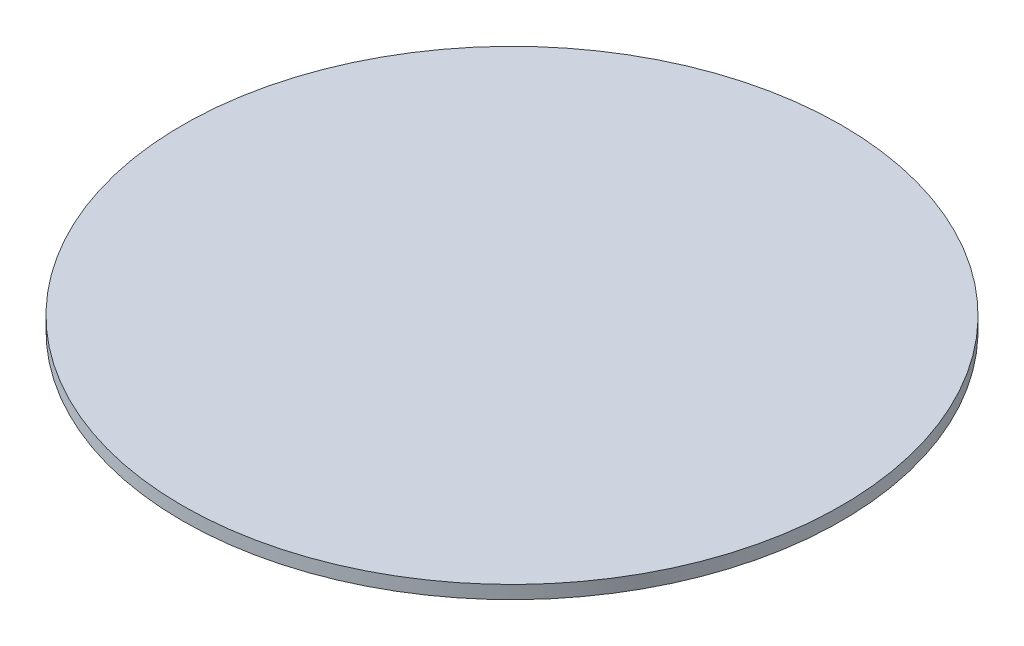
from build123d import *

# Parameters (mm, degrees)
SKETCH_1_R      = 150
EXTRUDE_1_DEPTH = 6


with BuildPart() as part:
    # 草图1 → 凸台-拉伸1 (new body)
    with BuildSketch(Plane(origin=(0, 0, 0), x_dir=(1, 0, 0), z_dir=(0, 1, 0))):
        with Locations(Location((0, 0, 0), (0, 0, 270))):
            Circle(SKETCH_1_R)
    extrude(amount=EXTRUDE_1_DEPTH)


solid = part.part
